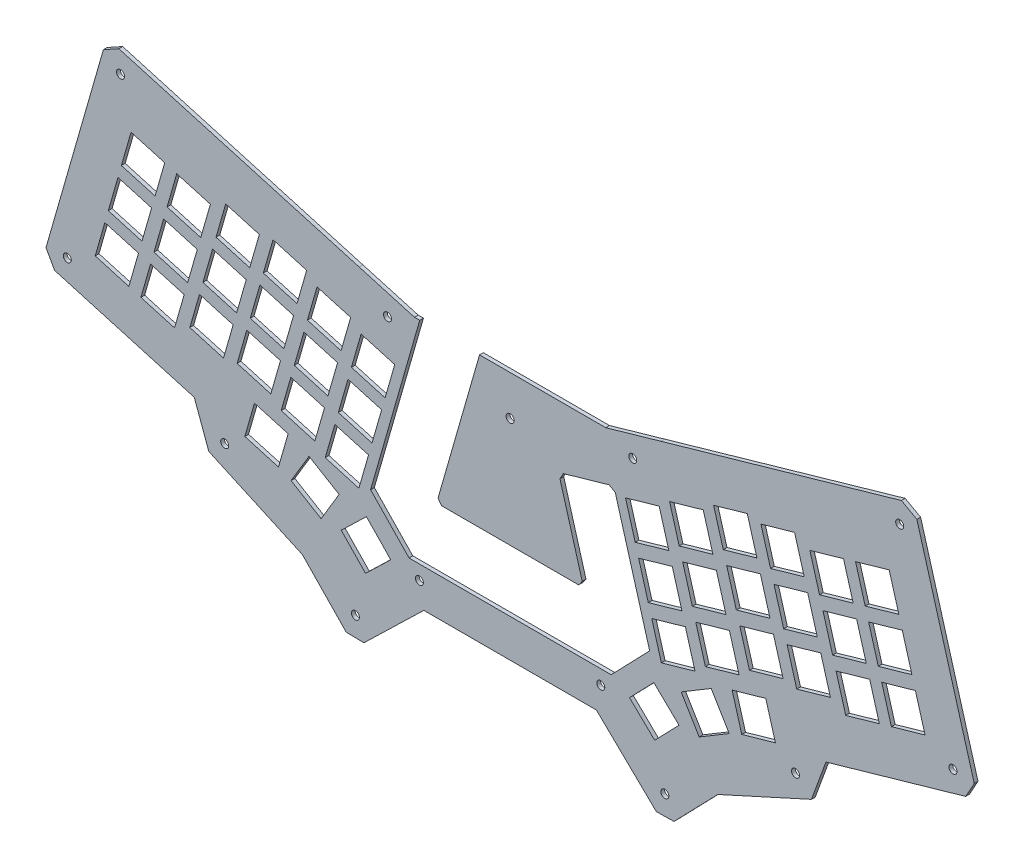
from build123d import *

# Parameters (mm, degrees)
ESQUISSE1_R        = 1.6
BOSS_EXTRU_1_DEPTH = 1.5


with BuildPart() as part:
    # Esquisse1 → Boss.-Extru.1 (new body)
    with BuildSketch(Plane.XY):
        Polygon((-102.267806075, -134.437972545), (-84.723821109, -116.319052626), (-47.296900898, -99.298065073), (-41.491708262, -83.459404935), (14.381168218, -67.438115415), (17.809289919, -61.253620157), (-5.137146777, 18.770114611), (-11.32171868, 22.19850363), (-107.454535032, -5.36135166), (-114.180015808, -7.289852239), (-129.565369241, -11.701531345), (-180.022233729, -11.701531345), (-196.635414175, -69.63857679), (-195.186688887, -71.561100182), (-140.403830856, -71.561100182), (-138.955105568, -69.63857679), (-147.87312166, -38.537758661), (-146.501872979, -36.063960558), (-128.237900757, -30.826850797), (-125.764102653, -32.198099477), (-111.998103132, -80.205845043), (-127.377713529, -96.161100182), (-131.349894367, -96.161100182), (-204.240625377, -96.161100182), (-208.212806214, -96.161100182), (-223.592416612, -80.205845043), (-203.949120754, -11.701531345), (-206.025150502, -11.701531345), (-221.410503936, -7.289852239), (-228.135984711, -5.36135166), (-324.268801063, 22.19850363), (-330.453372966, 18.770114611), (-353.399809662, -61.253620157), (-349.971687961, -67.438115415), (-294.098811481, -83.459404935), (-288.293618845, -99.298065073), (-250.866698634, -116.319052626), (-233.322713669, -134.437972545), (-226.255271496, -134.549159576), (-202.296830677, -111.350948678), (-133.293689066, -111.350948678), (-109.335248247, -134.549159576), align=None)
        with Locations((-12.000450916, 13.68165837)):
            Circle(ESQUISSE1_R, mode=Mode.SUBTRACT)
        with Locations((-118.757933777, -16.924131519)):
            Circle(ESQUISSE1_R, mode=Mode.SUBTRACT)
        with Locations((9.292284284, -60.574933915)):
            Circle(ESQUISSE1_R, mode=Mode.SUBTRACT)
        with Locations((-53.656180266, -93.401689518)):
            Circle(ESQUISSE1_R, mode=Mode.SUBTRACT)
        with Locations((-105.923928137, -126.713325795)):
            Circle(ESQUISSE1_R, mode=Mode.SUBTRACT)
        with Locations((-131.530967037, -101.880200807)):
            Circle(ESQUISSE1_R, mode=Mode.SUBTRACT)
        with Locations(Location((-204.059552706, -101.880200807, 0), (0, 0, 180))):
            Circle(ESQUISSE1_R, mode=Mode.SUBTRACT)
        with Locations(Location((-229.666591606, -126.713325795, 0), (0, 0, 180))):
            Circle(ESQUISSE1_R, mode=Mode.SUBTRACT)
        with Locations(Location((-281.934339477, -93.401689518, 0), (0, 0, 180))):
            Circle(ESQUISSE1_R, mode=Mode.SUBTRACT)
        with Locations(Location((-344.882804027, -60.574933915, 0), (0, 0, 180))):
            Circle(ESQUISSE1_R, mode=Mode.SUBTRACT)
        with Locations(Location((-216.832585966, -16.924131519, 0), (0, 0, 180))):
            Circle(ESQUISSE1_R, mode=Mode.SUBTRACT)
        with Locations(Location((-323.590068827, 13.68165837, 0), (0, 0, 180))):
            Circle(ESQUISSE1_R, mode=Mode.SUBTRACT)
        with Locations(Location((-167.795259872, -27.605548894, 0), (0, 0, 180))):
            Circle(ESQUISSE1_R, mode=Mode.SUBTRACT)
        Polygon((-121.646075908, -32.047544313), (-108.187467847, -28.188350553), (-104.328274087, -41.646958614), (-117.786882148, -45.506152375), align=None, mode=Mode.SUBTRACT)
        Polygon((-100.176299623, -37.98551269), (-104.035493384, -24.526904628), (-90.576885322, -20.667710868), (-86.717691562, -34.126318929), align=None, mode=Mode.SUBTRACT)
        Polygon((-82.565717099, -30.464873005), (-86.424910859, -17.006264943), (-72.966302798, -13.147071183), (-69.107109038, -26.605679244), align=None, mode=Mode.SUBTRACT)
        Polygon((-63.645764268, -27.510550239), (-67.504958028, -14.051942178), (-54.046349967, -10.192748417), (-50.187156207, -23.651356479), align=None, mode=Mode.SUBTRACT)
        Polygon((-44.071126284, -26.839385933), (-47.930320044, -13.380777872), (-34.471711983, -9.521584111), (-30.612518223, -22.980192173), align=None, mode=Mode.SUBTRACT)
        Polygon((-25.805370251, -21.601764674), (-29.664564011, -8.143156613), (-16.20595595, -4.283962852), (-12.346762189, -17.742570914), align=None, mode=Mode.SUBTRACT)
        Polygon((-116.408594683, -50.312811991), (-102.949986622, -46.453618231), (-99.090792861, -59.912226292), (-112.549400923, -63.771420052), align=None, mode=Mode.SUBTRACT)
        Polygon((-98.798012158, -42.792172306), (-85.339404097, -38.932978546), (-81.480210337, -52.391586607), (-94.938818398, -56.250780367), align=None, mode=Mode.SUBTRACT)
        Polygon((-81.187429634, -35.271532621), (-67.728821573, -31.412338861), (-63.869627812, -44.870946922), (-77.328235874, -48.730140682), align=None, mode=Mode.SUBTRACT)
        Polygon((-62.267476803, -32.317209855), (-48.808868742, -28.458016095), (-44.949674981, -41.916624156), (-58.408283043, -45.775817917), align=None, mode=Mode.SUBTRACT)
        Polygon((-42.692838819, -31.646045549), (-29.234230758, -27.786851789), (-25.375036997, -41.24545985), (-38.833645059, -45.104653611), align=None, mode=Mode.SUBTRACT)
        Polygon((-24.427082786, -26.40842429), (-10.968474724, -22.54923053), (-7.109280964, -36.007838591), (-20.567889026, -39.867032352), align=None, mode=Mode.SUBTRACT)
        Polygon((-19.189601561, -44.673691968), (-5.730993499, -40.814498208), (-1.871799739, -54.273106269), (-15.3304078, -58.132300029), align=None, mode=Mode.SUBTRACT)
        Polygon((-37.455357594, -49.911313227), (-23.996749532, -46.052119467), (-20.137555772, -59.510727528), (-33.596163833, -63.369921288), align=None, mode=Mode.SUBTRACT)
        Polygon((-57.029995578, -50.582477533), (-43.571387516, -46.723283773), (-39.712193756, -60.181891834), (-53.170801817, -64.041085594), align=None, mode=Mode.SUBTRACT)
        Polygon((-75.949948409, -53.536800299), (-62.491340347, -49.677606538), (-58.632146587, -63.1362146), (-72.090754648, -66.99540836), align=None, mode=Mode.SUBTRACT)
        Polygon((-93.560530933, -61.057439984), (-80.101922872, -57.198246223), (-76.242729111, -70.656854285), (-89.701337173, -74.516048045), align=None, mode=Mode.SUBTRACT)
        Polygon((-111.171113458, -68.578079669), (-97.712505396, -64.718885908), (-93.853311636, -78.17749397), (-107.311919697, -82.03668773), align=None, mode=Mode.SUBTRACT)
        Polygon((-79.018130302, -77.304798222), (-65.559522241, -73.445604462), (-61.700328481, -86.904212523), (-75.158936542, -90.763406284), align=None, mode=Mode.SUBTRACT)
        Polygon((-99.400078923, -88.135090111), (-87.391574532, -80.936247863), (-80.192732283, -92.944752254), (-92.201236674, -100.143594502), align=None, mode=Mode.SUBTRACT)
        Polygon((-120.049818618, -100.436716825), (-110.317049076, -90.371891716), (-100.252223967, -100.104661258), (-109.984993509, -110.169486367), align=None, mode=Mode.SUBTRACT)
        Polygon((-225.605526235, -110.169486367), (-215.540701125, -100.436716825), (-225.273470667, -90.371891716), (-235.338295776, -100.104661258), align=None, mode=Mode.SUBTRACT)
        Polygon((-243.389283069, -100.143594502), (-236.19044082, -88.135090111), (-248.198945211, -80.936247863), (-255.39778746, -92.944752254), align=None, mode=Mode.SUBTRACT)
        Polygon((-260.431583201, -90.763406284), (-256.572389441, -77.304798222), (-270.030997502, -73.445604462), (-273.890191262, -86.904212523), align=None, mode=Mode.SUBTRACT)
        Polygon((-228.278600046, -82.03668773), (-224.419406286, -68.578079669), (-237.878014347, -64.718885908), (-241.737208107, -78.17749397), align=None, mode=Mode.SUBTRACT)
        Polygon((-245.88918257, -74.516048045), (-242.02998881, -61.057439984), (-255.488596871, -57.198246223), (-259.347790632, -70.656854285), align=None, mode=Mode.SUBTRACT)
        Polygon((-263.499765095, -66.99540836), (-259.640571335, -53.536800299), (-273.099179396, -49.677606538), (-276.958373156, -63.1362146), align=None, mode=Mode.SUBTRACT)
        Polygon((-282.419717926, -64.041085594), (-278.560524165, -50.582477533), (-292.019132227, -46.723283773), (-295.878325987, -60.181891834), align=None, mode=Mode.SUBTRACT)
        Polygon((-301.99435591, -63.369921288), (-298.135162149, -49.911313227), (-311.593770211, -46.052119467), (-315.452963971, -59.510727528), align=None, mode=Mode.SUBTRACT)
        Polygon((-320.260111943, -58.132300029), (-316.400918183, -44.673691968), (-329.859526244, -40.814498208), (-333.718720004, -54.273106269), align=None, mode=Mode.SUBTRACT)
        Polygon((-315.022630718, -39.867032352), (-311.163436957, -26.40842429), (-324.622045019, -22.54923053), (-328.481238779, -36.007838591), align=None, mode=Mode.SUBTRACT)
        Polygon((-296.756874684, -45.104653611), (-292.897680924, -31.646045549), (-306.356288985, -27.786851789), (-310.215482746, -41.24545985), align=None, mode=Mode.SUBTRACT)
        Polygon((-277.1822367, -45.775817917), (-273.32304294, -32.317209855), (-286.781651001, -28.458016095), (-290.640844762, -41.916624156), align=None, mode=Mode.SUBTRACT)
        Polygon((-258.26228387, -48.730140682), (-254.403090109, -35.271532621), (-267.861698171, -31.412338861), (-271.720891931, -44.870946922), align=None, mode=Mode.SUBTRACT)
        Polygon((-240.651701345, -56.250780367), (-236.792507585, -42.792172306), (-250.251115646, -38.932978546), (-254.110309406, -52.391586607), align=None, mode=Mode.SUBTRACT)
        Polygon((-223.041118821, -63.771420052), (-219.18192506, -50.312811991), (-232.640533122, -46.453618231), (-236.499726882, -59.912226292), align=None, mode=Mode.SUBTRACT)
        Polygon((-323.243757554, -17.742570914), (-309.785149492, -21.601764674), (-305.925955732, -8.143156613), (-319.384563793, -4.283962852), align=None, mode=Mode.SUBTRACT)
        Polygon((-304.97800152, -22.980192173), (-291.519393459, -26.839385933), (-287.660199699, -13.380777872), (-301.11880776, -9.521584111), align=None, mode=Mode.SUBTRACT)
        Polygon((-285.403363536, -23.651356479), (-271.944755475, -27.510550239), (-268.085561715, -14.051942178), (-281.544169776, -10.192748417), align=None, mode=Mode.SUBTRACT)
        Polygon((-266.483410706, -26.605679244), (-253.024802644, -30.464873005), (-249.165608884, -17.006264943), (-262.624216945, -13.147071183), align=None, mode=Mode.SUBTRACT)
        Polygon((-248.872828181, -34.126318929), (-235.41422012, -37.98551269), (-231.555026359, -24.526904628), (-245.013634421, -20.667710868), align=None, mode=Mode.SUBTRACT)
        Polygon((-217.803637595, -45.506152375), (-213.944443835, -32.047544313), (-227.403051896, -28.188350553), (-231.262245657, -41.646958614), align=None, mode=Mode.SUBTRACT)
    extrude(amount=BOSS_EXTRU_1_DEPTH)


solid = part.part
